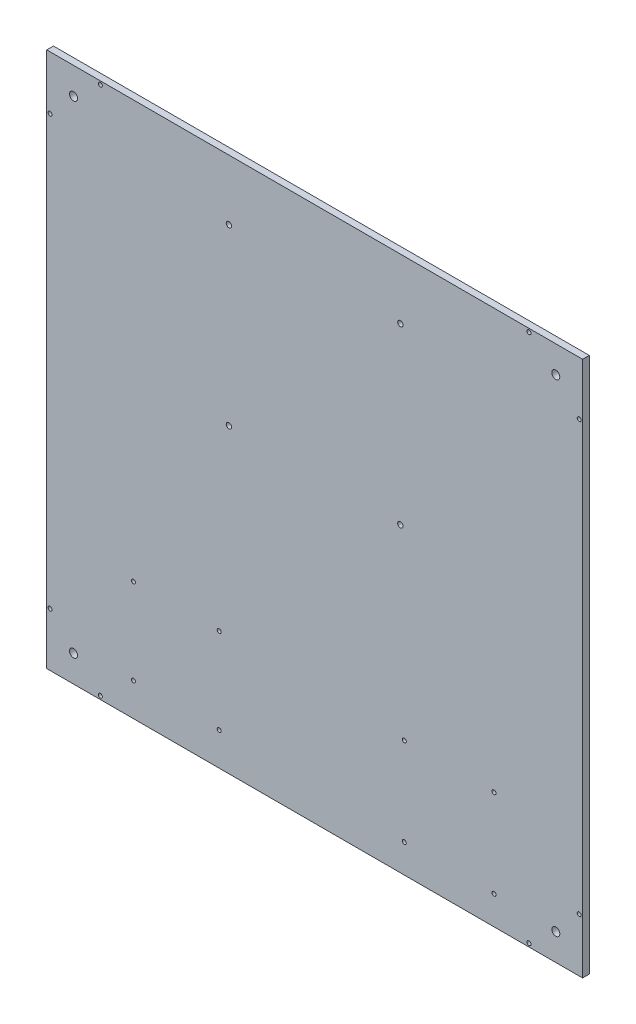
from build123d import *

# Parameters (mm, degrees)
SKETCH1_W           = 400
SKETCH1_H           = 400
SKETCH1_R           = 3
SKETCH1_R_2         = 2
SKETCH1_R_3         = 1.5
BOSS_EXTRUDE1_DEPTH = 5


with BuildPart() as part:
    # Sketch1 → Boss-Extrude1 (new body)
    with BuildSketch(Plane.XY):
        with Locations((200, 200)):
            Rectangle(SKETCH1_W, SKETCH1_H)
        with Locations((20, 380)):
            Circle(SKETCH1_R, mode=Mode.SUBTRACT)
        with Locations((20, 20)):
            Circle(SKETCH1_R, mode=Mode.SUBTRACT)
        with Locations((380, 20)):
            Circle(SKETCH1_R, mode=Mode.SUBTRACT)
        with Locations((380, 380)):
            Circle(SKETCH1_R, mode=Mode.SUBTRACT)
        with Locations((136, 355)):
            Circle(SKETCH1_R_2, mode=Mode.SUBTRACT)
        with Locations((136, 225)):
            Circle(SKETCH1_R_2, mode=Mode.SUBTRACT)
        with Locations((264, 225)):
            Circle(SKETCH1_R_2, mode=Mode.SUBTRACT)
        with Locations((264, 355)):
            Circle(SKETCH1_R_2, mode=Mode.SUBTRACT)
        with Locations((40, 2.5)):
            Circle(SKETCH1_R_3, mode=Mode.SUBTRACT)
        with Locations((2.5, 40)):
            Circle(SKETCH1_R_3, mode=Mode.SUBTRACT)
        with Locations((2.5, 360)):
            Circle(SKETCH1_R_3, mode=Mode.SUBTRACT)
        with Locations((397.5, 360)):
            Circle(SKETCH1_R_3, mode=Mode.SUBTRACT)
        with Locations((360, 2.5)):
            Circle(SKETCH1_R_3, mode=Mode.SUBTRACT)
        with Locations((40, 397.5)):
            Circle(SKETCH1_R_3, mode=Mode.SUBTRACT)
        with Locations((360, 397.5)):
            Circle(SKETCH1_R_3, mode=Mode.SUBTRACT)
        with Locations((397.5, 40)):
            Circle(SKETCH1_R_3, mode=Mode.SUBTRACT)
        with Locations((333.89, 21.385)):
            Circle(SKETCH1_R_3, mode=Mode.SUBTRACT)
        with Locations((266.89, 21.385)):
            Circle(SKETCH1_R_3, mode=Mode.SUBTRACT)
        with Locations((266.89, 87.056)):
            Circle(SKETCH1_R_3, mode=Mode.SUBTRACT)
        with Locations((333.89, 87.056)):
            Circle(SKETCH1_R_3, mode=Mode.SUBTRACT)
        with Locations((128.75, 24.663)):
            Circle(SKETCH1_R_3, mode=Mode.SUBTRACT)
        with Locations((64.755, 24.66)):
            Circle(SKETCH1_R_3, mode=Mode.SUBTRACT)
        with Locations((128.75, 88.663)):
            Circle(SKETCH1_R_3, mode=Mode.SUBTRACT)
        with Locations((64.75, 88.66)):
            Circle(SKETCH1_R_3, mode=Mode.SUBTRACT)
    extrude(amount=BOSS_EXTRUDE1_DEPTH)


solid = part.part
